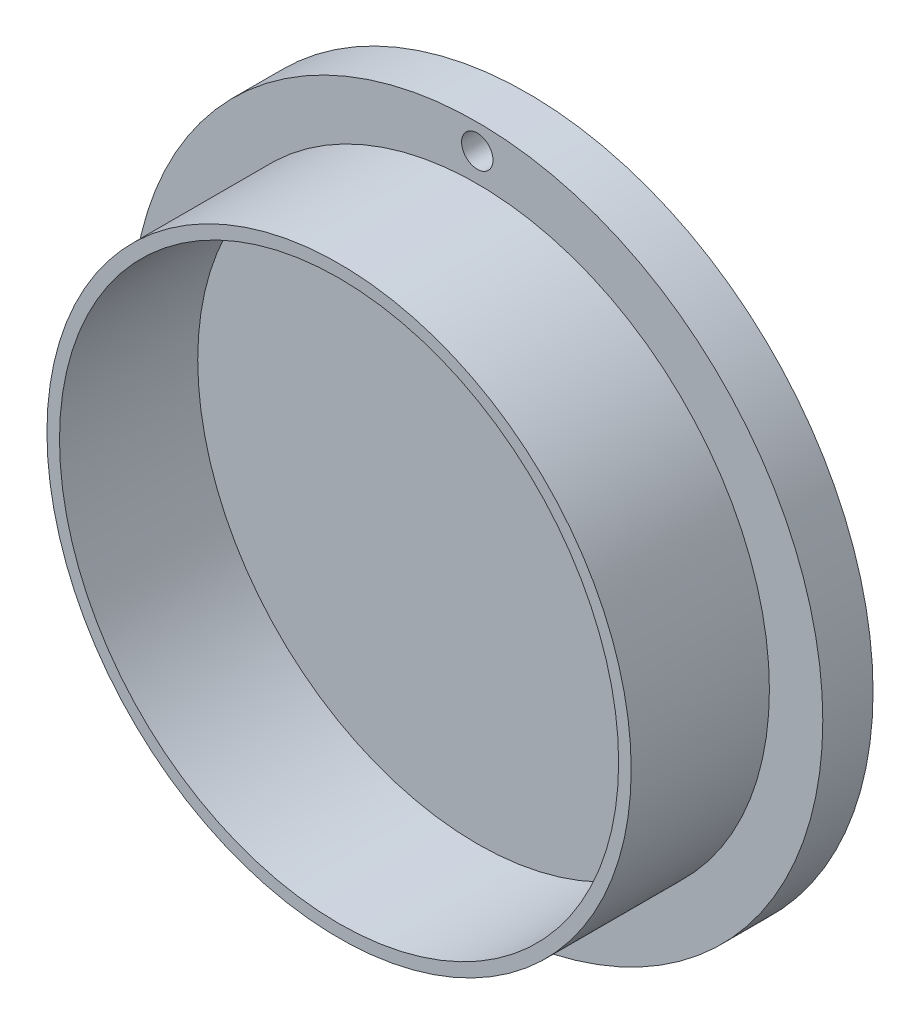
from build123d import *

# Parameters (mm, degrees)
SKETCH1_R               = 46.5
BOSS_EXTRUDE1_DEPTH     = 30
SKETCH1_3_R             = 55
SKETCH1_3_R_2           = 46.5
BOSS_EXTRUDE2_DEPTH     = 8
CUT_EXTRUDE1_DEPTH      = 81.833161512
CUT_EXTRUDE1_DEPTH_BACK = 81.833161512
SKETCH2_R               = 2.5
SKETCH3_R               = 44.5
CUT_EXTRUDE2_DEPTH      = 22


with BuildPart() as part:
    # Sketch1 → Boss-Extrude1 (new body)
    with BuildSketch(Plane.XY):
        Circle(SKETCH1_R)
    extrude(amount=BOSS_EXTRUDE1_DEPTH)

    # Sketch1<3> → Boss-Extrude2 (add)
    with BuildSketch(Plane.XY):
        Circle(SKETCH1_3_R)
        Circle(SKETCH1_3_R_2, mode=Mode.SUBTRACT)
    extrude(amount=BOSS_EXTRUDE2_DEPTH)

    # Sketch2 → Cut-Extrude1 (cut, two sides: drawn at the far end of the back side and taken through both)
    with BuildSketch(Plane.XY.offset(8).offset(-CUT_EXTRUDE1_DEPTH_BACK)):
        with Locations((0, 51)):
            Circle(SKETCH2_R)
        with Locations((0, -51)):
            Circle(SKETCH2_R)
    extrude(amount=CUT_EXTRUDE1_DEPTH + CUT_EXTRUDE1_DEPTH_BACK, mode=Mode.SUBTRACT)

    # Sketch3 → Cut-Extrude2 (cut)
    with BuildSketch(Plane.XY.offset(30)):
        Circle(SKETCH3_R)
    extrude(amount=-CUT_EXTRUDE2_DEPTH, mode=Mode.SUBTRACT)


solid = part.part
